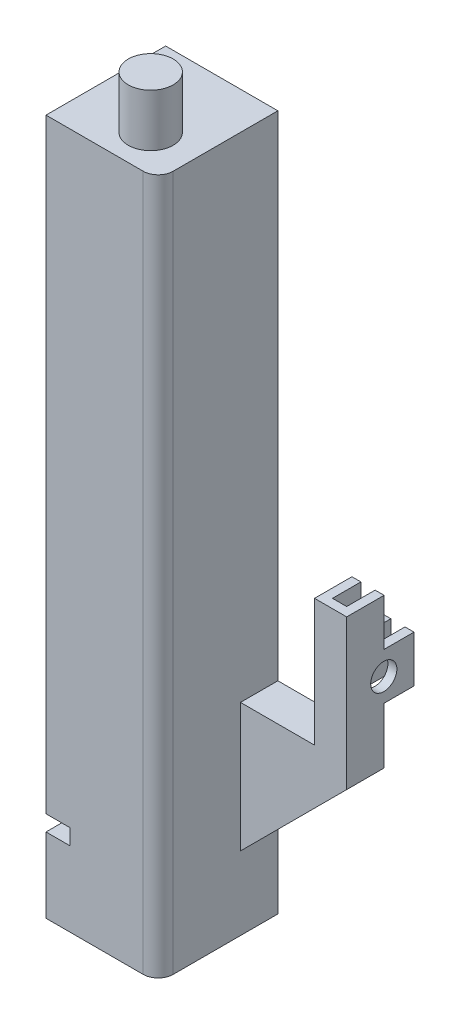
from build123d import *

# Parameters (mm, degrees)
SKETCH1_W                       = 15
SKETCH1_H                       = 15
BOSS_EXTRUDE1_DEPTH             = 93
SKETCH2_R                       = 3
BOSS_EXTRUDE2_DEPTH             = 7
FILLET1_R                       = 2
BOSS_EXTRUDE3_DEPTH             = 1
BOSS_EXTRUDE3_DEPTH_BACK        = 4
SKETCH5_W                       = 1.2
SKETCH5_H                       = 17
SKETCH6_W                       = 4.3
SKETCH6_H                       = 20
BOSS_EXTRUDE4_DEPTH             = 1.2
BOSS_EXTRUDE5_REACH             = 106.522
SKETCH9_W                       = 1.9
SKETCH9_H                       = 20
CUT_EXTRUDE2_DEPTH              = 17
SKETCH10_R                      = 1.75
CUT_EXTRUDE3_DEPTH              = 10
SKETCH11_W                      = 1
SKETCH11_H                      = 3
BOSS_EXTRUDE6_DEPTH             = 15
BOSS_EXTRUDE7_REACH             = 79.176
SKETCH12_W                      = 15
SKETCH12_H                      = 1
BOSS_EXTRUDE7_DIRECTION_2_REACH = 79.176
SKETCH3_W                       = 3.2
SKETCH3_H                       = 2.1
CUT_EXTRUDE1_DEPTH              = 105.263560269
BOSS_EXTRUDE8_DEPTH             = 5


with BuildPart() as part:
    # Sketch1 → Boss-Extrude1 (new body)
    with BuildSketch(Plane(origin=(0, 0, 0), x_dir=(1, 0, 0), z_dir=(0, 1, 0))):
        Rectangle(SKETCH1_W, SKETCH1_H)
    extrude(amount=BOSS_EXTRUDE1_DEPTH)

    # Sketch2 → Boss-Extrude2 (add)
    with BuildSketch(Plane(origin=(0, 93, 0), x_dir=(1, 0, 0), z_dir=(0, 1, 0))):
        with Locations(Location((1.5, -2.5, 0), (0, 0, 90))):
            Circle(SKETCH2_R)
    extrude(amount=BOSS_EXTRUDE2_DEPTH)

    # Fillet1
    fillet1_edges = [part.edges().sort_by_distance(p)[0] for p in [
        (7.5, 46.5, 7.5),
    ]]
    fillet(fillet1_edges, radius=FILLET1_R)

    # Sketch5 → Boss-Extrude3 (add, two sides: drawn at the far end of the back side and taken through both)
    with BuildSketch(Plane(origin=(0, 0, -7.5), x_dir=(-1, 0, 0), z_dir=(0, 0, -1)).offset(-BOSS_EXTRUDE3_DEPTH_BACK)):
        Polygon((-21.7, 24), (-7.5, 24), (-7.5, 27), (-17.4, 27), (-18.6, 27), (-20.5, 27), (-20.5, 44), (-21.7, 44), align=None)
        with Locations((-18, 35.5)):
            Rectangle(SKETCH5_W, SKETCH5_H)
    extrude(amount=BOSS_EXTRUDE3_DEPTH + BOSS_EXTRUDE3_DEPTH_BACK)

    # Sketch6 → Boss-Extrude4 (add)
    with BuildSketch(Plane.XY.offset(-3.5)):
        with Locations((19.55, 34)):
            Rectangle(SKETCH6_W, SKETCH6_H)
    extrude(amount=-BOSS_EXTRUDE4_DEPTH)

    # Boss-Extrude5: up to this face of the body (flat: up to its plane)
    boss_extrude5_end = Plane(part.part.faces().sort_by_distance((17.4, 35.5, -6))[0])
    # Sketch7 → Boss-Extrude5 (add, up to the picked face)
    with BuildSketch(Plane(origin=(21.7, 0, 0), x_dir=(0, 0, -1), z_dir=(1, 0, 0)), mode=Mode.PRIVATE) as boss_extrude5_sk1:
        Polygon((5.5, 34.5), (5.5, 44), (8.5, 44), (8.5, 37.74), (12.5, 37.74), (12.5, 31.5), (8.5, 31.5), align=None)
    boss_extrude5_tool1 = split(extrude(boss_extrude5_sk1.sketch, amount=-BOSS_EXTRUDE5_REACH, mode=Mode.PRIVATE), bisect_by=boss_extrude5_end, keep=Keep.BOTH, mode=Mode.PRIVATE)
    add(boss_extrude5_tool1.solids().sort_by(Axis((21.7, 36.8097, -8.546066), (-1, 0, 0)))[0])

    # Sketch9 → Cut-Extrude2 (cut)
    with BuildSketch(Plane(origin=(0, 44, 0), x_dir=(1, 0, 0), z_dir=(0, 1, 0))):
        with Locations((19.55, 14.7)):
            Rectangle(SKETCH9_W, SKETCH9_H)
    extrude(amount=-CUT_EXTRUDE2_DEPTH, mode=Mode.SUBTRACT)

    # Sketch10 → Cut-Extrude3 (cut)
    with BuildSketch(Plane(origin=(21.7, 0, 0), x_dir=(0, 0, -1), z_dir=(1, 0, 0))):
        with Locations(Location((8.46, 34.62, 0), (0, 0, 90))):
            Circle(SKETCH10_R)
    extrude(amount=-CUT_EXTRUDE3_DEPTH, mode=Mode.SUBTRACT)

    # Sketch11 → Boss-Extrude6 (add)
    with BuildSketch(Plane.ZY.offset(-7.5)):
        with Locations((-8, 25.5)):
            Rectangle(SKETCH11_W, SKETCH11_H)
    extrude(amount=BOSS_EXTRUDE6_DEPTH)

    # Boss-Extrude7: up to this face of the body (flat: up to its plane)
    boss_extrude7_end = Plane(part.part.faces().sort_by_distance((-0.247443472, 93, -0.391798042))[0])
    # Sketch12 → Boss-Extrude7 (add, up to the picked face)
    with BuildSketch(Plane(origin=(0, 27, 0), x_dir=(1, 0, 0), z_dir=(0, 1, 0)), mode=Mode.PRIVATE) as boss_extrude7_sk1:
        with Locations((0, 8)):
            Rectangle(SKETCH12_W, SKETCH12_H)
    boss_extrude7_tool1 = split(extrude(boss_extrude7_sk1.sketch, amount=BOSS_EXTRUDE7_REACH, mode=Mode.PRIVATE), bisect_by=boss_extrude7_end, keep=Keep.BOTH, mode=Mode.PRIVATE)
    add(boss_extrude7_tool1.solids().sort_by(Axis((0, 27, -8), (0, 1, 0)))[0])

    # Boss-Extrude7 direction 2: up to this face of the body (flat: up to its plane)
    boss_extrude7_direction_2_end = Plane(part.part.faces().sort_by_distance((-0.027012272, 0, -0.027012272))[0])
    # Sketch12 → Boss-Extrude7 direction 2 (add, up to the picked face)
    with BuildSketch(Plane(origin=(0, 27, 0), x_dir=(1, 0, 0), z_dir=(0, 1, 0)), mode=Mode.PRIVATE) as boss_extrude7_direction_2_sk1:
        with Locations((0, 8)):
            Rectangle(SKETCH12_W, SKETCH12_H)
    boss_extrude7_direction_2_tool1 = split(extrude(boss_extrude7_direction_2_sk1.sketch, amount=-BOSS_EXTRUDE7_DIRECTION_2_REACH, mode=Mode.PRIVATE), bisect_by=boss_extrude7_direction_2_end, keep=Keep.BOTH, mode=Mode.PRIVATE)
    add(boss_extrude7_direction_2_tool1.solids().sort_by(Axis((0, 27, -8), (0, -1, 0)))[0])

    # Sketch3 → Cut-Extrude1 (cut, through all)
    with BuildSketch(Plane.XY.offset(7.5)):
        with Locations((-5.9, 11.05)):
            Rectangle(SKETCH3_W, SKETCH3_H)
    extrude(amount=-CUT_EXTRUDE1_DEPTH, mode=Mode.SUBTRACT)

    # Sketch13 → Boss-Extrude8 (add)
    with BuildSketch(Plane.XY.offset(-3.5)):
        Polygon((21.7, 24), (7.5, 24), (7.5, 9.8), align=None)
    extrude(amount=-BOSS_EXTRUDE8_DEPTH)


solid = part.part
